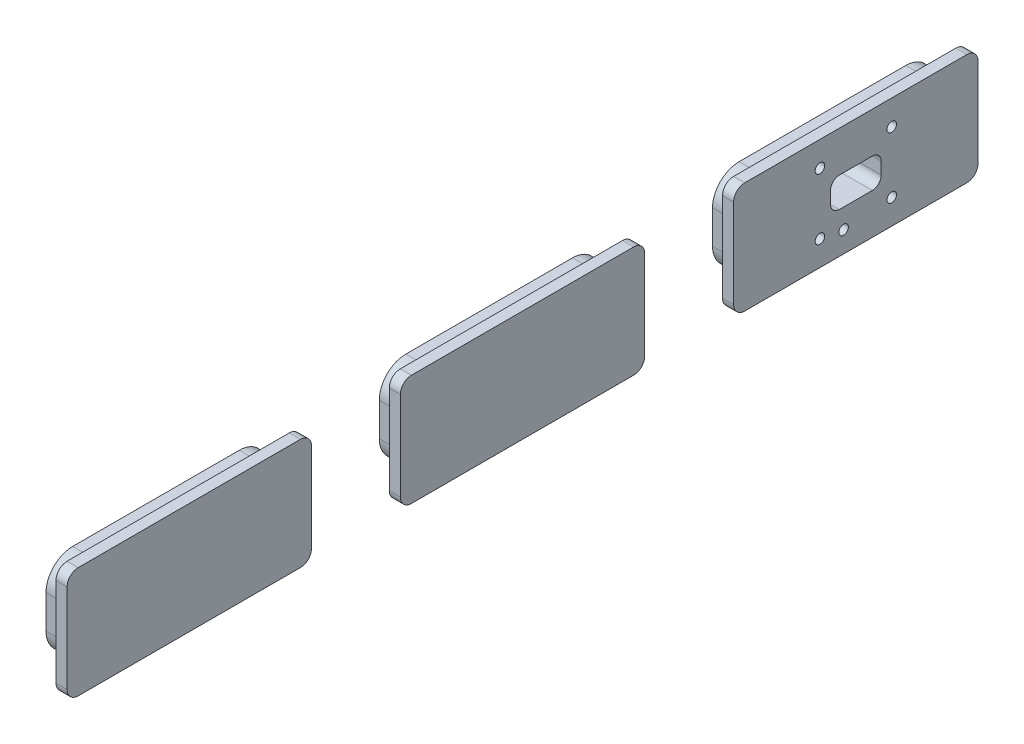
from build123d import *

# Parameters (mm, degrees)
BOSS_EXTRUDE1_DEPTH   = 10
BOSS_EXTRUDE1_2_DEPTH = 10
BOSS_EXTRUDE1_3_DEPTH = 10
BOSS_EXTRUDE2_DEPTH   = 5
SKETCH5_R             = 2.15
CUT_EXTRUDE3_DEPTH    = 221.205129425


with BuildPart() as part:
    # Sketch1 → Boss-Extrude1 (new body)
    with BuildSketch(Plane.ZY.offset(330.42)):
        with BuildLine():
            Line((53.405, 35.5), (53.405, 50.5))
            ThreePointArc((53.405, 50.5), (49.890281374, 58.985281374), (41.405, 62.5))
            Line((41.405, 62.5), (-33.595, 62.5))
            ThreePointArc((-33.595, 62.5), (-42.080281374, 58.985281374), (-45.595, 50.5))
            Line((-45.595, 50.5), (-45.595, 35.5))
            ThreePointArc((-45.595, 35.5), (-42.080281374, 27.014718626), (-33.595, 23.5))
            Line((-33.595, 23.5), (41.405, 23.5))
            ThreePointArc((41.405, 23.5), (49.890281374, 27.014718626), (53.405, 35.5))
        make_face()
    extrude(amount=-BOSS_EXTRUDE1_DEPTH)



with BuildPart() as body_2:
    # Sketch1 → Boss-Extrude1 2 (new body)
    with BuildSketch(Plane.ZY.offset(330.42)):
        with BuildLine():
            Line((-96.595, 35.5), (-96.595, 50.5))
            ThreePointArc((-96.595, 50.5), (-100.109718626, 58.985281374), (-108.595, 62.5))
            Line((-108.595, 62.5), (-183.595, 62.5))
            ThreePointArc((-183.595, 62.5), (-192.080281374, 58.985281374), (-195.595, 50.5))
            Line((-195.595, 50.5), (-195.595, 35.5))
            ThreePointArc((-195.595, 35.5), (-192.080281374, 27.014718626), (-183.595, 23.5))
            Line((-183.595, 23.5), (-108.595, 23.5))
            ThreePointArc((-108.595, 23.5), (-100.109718626, 27.014718626), (-96.595, 35.5))
        make_face()
    extrude(amount=-BOSS_EXTRUDE1_2_DEPTH)


with BuildPart() as body_3:
    # Sketch1 → Boss-Extrude1 3 (new body)
    with BuildSketch(Plane.ZY.offset(330.42)):
        with BuildLine():
            Line((203.405, 35.5), (203.405, 50.5))
            ThreePointArc((203.405, 50.5), (199.890281374, 58.985281374), (191.405, 62.5))
            Line((191.405, 62.5), (116.405, 62.5))
            ThreePointArc((116.405, 62.5), (107.919718626, 58.985281374), (104.405, 50.5))
            Line((104.405, 50.5), (104.405, 35.5))
            ThreePointArc((104.405, 35.5), (107.919718626, 27.014718626), (116.405, 23.5))
            Line((116.405, 23.5), (191.405, 23.5))
            ThreePointArc((191.405, 23.5), (199.890281374, 27.014718626), (203.405, 35.5))
        make_face()
    extrude(amount=-BOSS_EXTRUDE1_3_DEPTH)


with BuildPart() as part_1:
    add(part.part)

    add(body_2.part)  # Boss-Extrude2 merges body 2

    add(body_3.part)  # Boss-Extrude2 merges body 3
    # Sketch2 → Boss-Extrude2 (add)
    with BuildSketch(Plane(origin=(-320.42, 0, 0), x_dir=(0, 0, -1), z_dir=(1, 0, 0))):
        with BuildLine():
            Line((51.095, 23), (51.095, 63))
            ThreePointArc((51.095, 63), (49.630533906, 66.535533906), (46.095, 68))
            Line((46.095, 68), (-53.905, 68))
            ThreePointArc((-53.905, 68), (-57.440533906, 66.535533906), (-58.905, 63))
            Line((-58.905, 63), (-58.905, 23))
            ThreePointArc((-58.905, 23), (-57.440533906, 19.464466094), (-53.905, 18))
            Line((-53.905, 18), (46.095, 18))
            ThreePointArc((46.095, 18), (49.630533906, 19.464466094), (51.095, 23))
        make_face()
        with BuildLine():
            Line((201.095, 23), (201.095, 63))
            ThreePointArc((201.095, 63), (199.630533906, 66.535533906), (196.095, 68))
            Line((196.095, 68), (96.095, 68))
            ThreePointArc((96.095, 68), (92.559466094, 66.535533906), (91.095, 63))
            Line((91.095, 63), (91.095, 23))
            ThreePointArc((91.095, 23), (92.559466094, 19.464466094), (96.095, 18))
            Line((96.095, 18), (196.095, 18))
            ThreePointArc((196.095, 18), (199.630533906, 19.464466094), (201.095, 23))
        make_face()
        with BuildLine():
            Line((-98.905, 23), (-98.905, 63))
            ThreePointArc((-98.905, 63), (-100.369466094, 66.535533906), (-103.905, 68))
            Line((-103.905, 68), (-203.905, 68))
            ThreePointArc((-203.905, 68), (-207.440533906, 66.535533906), (-208.905, 63))
            Line((-208.905, 63), (-208.905, 23))
            ThreePointArc((-208.905, 23), (-207.440533906, 19.464466094), (-203.905, 18))
            Line((-203.905, 18), (-103.905, 18))
            ThreePointArc((-103.905, 18), (-100.369466094, 19.464466094), (-98.905, 23))
        make_face()
    extrude(amount=BOSS_EXTRUDE2_DEPTH)

    # Sketch5 → Cut-Extrude3 (cut, through all)
    with BuildSketch(Plane.ZY.offset(330.42)):
        with Locations((-162.245, 56.75)):
            Circle(SKETCH5_R)
        with Locations((-129.945, 56.75)):
            Circle(SKETCH5_R)
        with Locations((-129.945, 29.25)):
            Circle(SKETCH5_R)
        with Locations((-162.245, 29.25)):
            Circle(SKETCH5_R)
        with Locations((-140.595, 27.45)):
            Circle(SKETCH5_R)
        with BuildLine():
            Line((-153.495, 49.7), (-138.695, 49.7))
            ThreePointArc((-138.695, 49.7), (-135.866572875, 48.528427125), (-134.695, 45.7))
            Line((-134.695, 45.7), (-134.695, 40.3))
            ThreePointArc((-134.695, 40.3), (-135.866572875, 37.471572875), (-138.695, 36.3))
            Line((-138.695, 36.3), (-153.495, 36.3))
            ThreePointArc((-153.495, 36.3), (-156.323427125, 37.471572875), (-157.495, 40.3))
            Line((-157.495, 40.3), (-157.495, 45.7))
            ThreePointArc((-157.495, 45.7), (-156.323427125, 48.528427125), (-153.495, 49.7))
        make_face()
    extrude(amount=-CUT_EXTRUDE3_DEPTH, mode=Mode.SUBTRACT)


solid = part_1.part
